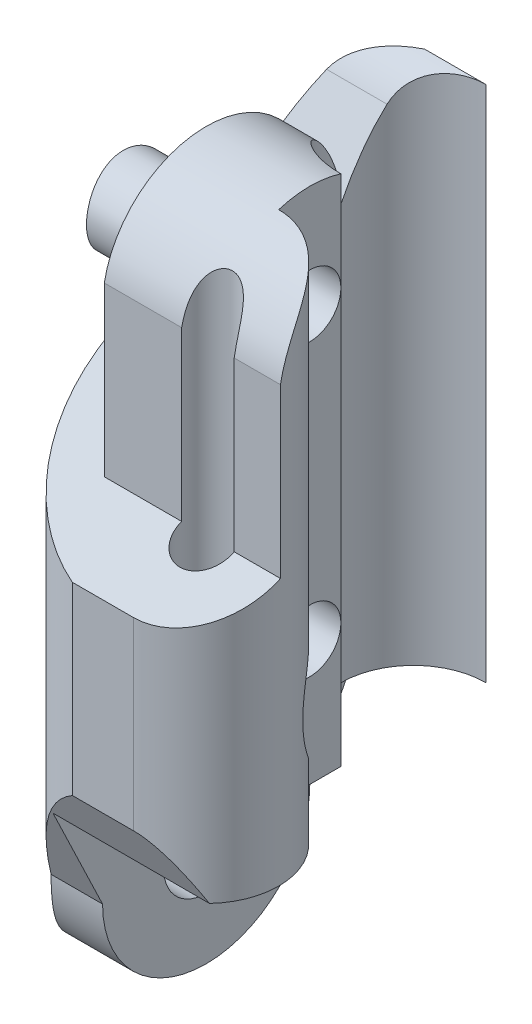
from build123d import *

# Parameters (mm, degrees)
BOSS_EXTRUDE1_DEPTH = 35
SKETCH2_R           = 1.27
CUT_EXTRUDE1_DEPTH  = 35
CUT_EXTRUDE2_REACH  = 41.937
SKETCH3_W           = 10
SKETCH3_H           = 10
SKETCH4_R           = 2.049999964
CUT_EXTRUDE3_DEPTH  = 17.5
CUT_EXTRUDE5_START  = -7.95804
SKETCH6_R           = 2
CUT_EXTRUDE5_DEPTH  = 9.6
FILLET3_R           = 1
CUT_EXTRUDE6_START  = 8.64596
SKETCH6_3_R         = 2
CUT_EXTRUDE6_DEPTH  = 6.604
CUT_EXTRUDE7_START  = -14.986
CUT_EXTRUDE7_DEPTH  = 14.986
CUT_EXTRUDE8_DEPTH  = 31.496
SKETCH9_R           = 1.5
CUT_EXTRUDE9_DEPTH  = 14.224
CUT_EXTRUDE11_DEPTH = 6.048
SKETCH13_R          = 1.5
CUT_EXTRUDE12_DEPTH = 3
CUT_EXTRUDE13_START = -5.5
SKETCH15_R          = 2.75
CUT_EXTRUDE13_DEPTH = 7.572


with BuildPart() as part:
    # Sketch1 → Boss-Extrude1 (new body)
    with BuildSketch(Plane(origin=(0, 0, 0), x_dir=(1, 0, 0), z_dir=(0, 1, 0))):
        with BuildLine():
            Line((-2.958039892, 8.5), (2.958039892, 8.5))
            ThreePointArc((2.958039892, 8.5), (9, 0), (2.958039892, -8.5))
            Line((2.958039892, -8.5), (-2.958039892, -8.5))
            ThreePointArc((-2.958039892, -8.5), (-9, 0), (-2.958039892, 8.5))
        make_face()
    extrude(amount=BOSS_EXTRUDE1_DEPTH)

    # Sketch2 → Cut-Extrude1 (cut)
    with BuildSketch(Plane.XZ):
        with Locations(Location((0, -5, 0), (0, 0, 270))):
            Circle(SKETCH2_R)
        with Locations(Location((0, 5, 0), (0, 0, 270))):
            Circle(SKETCH2_R)
    extrude(amount=-CUT_EXTRUDE1_DEPTH, mode=Mode.SUBTRACT)

    # Cut-Extrude2: up to this face of the body (flat: up to its plane)
    cut_extrude2_end = Plane(part.part.faces().sort_by_distance((0, 17.5, 8.5))[0])
    # Sketch3 → Cut-Extrude2 (cut, up to the picked face)
    with BuildSketch(Plane(origin=(0, 0, -8.5), x_dir=(-1, 0, 0), z_dir=(0, 0, -1)), mode=Mode.PRIVATE) as cut_extrude2_sk1:
        with Locations((0, 5)):
            Rectangle(SKETCH3_W, SKETCH3_H)
    cut_extrude2_tool1 = split(extrude(cut_extrude2_sk1.sketch, amount=-CUT_EXTRUDE2_REACH, mode=Mode.PRIVATE), bisect_by=cut_extrude2_end, keep=Keep.BOTH, mode=Mode.PRIVATE)
    add(cut_extrude2_tool1.solids().sort_by(Axis((0, 5, -8.5), (0, 0, 1)))[0], mode=Mode.SUBTRACT)

    # Sketch4 → Cut-Extrude3 (cut, symmetric)
    with BuildSketch(Plane.ZY.offset(-5)):
        with Locations(Location((0, 5, 0), (0, 0, 270))):
            Circle(SKETCH4_R)
        with BuildLine():
            Line((-7.483314774, 10), (-5, 5))
            ThreePointArc((-5, 5), (0, 0), (5, 5))
            Line((5, 5), (8.5, 12.308552788))
            Line((8.5, 12.308552788), (9.857943437, -1.822240199))
            Line((9.857943437, -1.822240199), (-9.857943437, -1.822240199))
            Line((-9.857943437, -1.822240199), (-7.483314774, 10))
        make_face()
    extrude(amount=CUT_EXTRUDE3_DEPTH, both=True, mode=Mode.SUBTRACT)

    # Sketch6 → Cut-Extrude5 (cut)
    with BuildSketch(Plane.ZY.offset(2.958039892).offset(CUT_EXTRUDE5_START)):
        with BuildLine():
            Line((8.5, 21.219917379), (0, 25))
            ThreePointArc((0, 25), (-3.535533906, 26.464466094), (-5, 30))
            Line((-5, 30), (-6.755867779, 33.535330675))
            ThreePointArc((-6.755867779, 33.535330675), (-7.475170692, 34.449576169), (-8.5, 35))
            Line((-8.5, 35), (17.803004008, 42.886049022))
            Line((17.803004008, 42.886049022), (8.5, 21.219917379))
        make_face()
        with Locations((0, 30)):
            Circle(SKETCH6_R, mode=Mode.SUBTRACT)
    extrude(amount=-CUT_EXTRUDE5_DEPTH, mode=Mode.SUBTRACT)

    # Fillet3
    fillet3_edges = [part.edges().sort_by_distance(p)[0] for p in [
        (0, 10, -3.73),
        (0, 10, 6.27),
    ]]
    fillet(fillet3_edges, radius=FILLET3_R)

    # Sketch6<3> → Cut-Extrude6 (cut)
    with BuildSketch(Plane.ZY.offset(2.958039892).offset(CUT_EXTRUDE6_START)):
        with BuildLine():
            Line((8.5, 21.219917379), (0, 25))
            ThreePointArc((0, 25), (-3.535533906, 26.464466094), (-5, 30))
            Line((-5, 30), (-6.755867779, 33.535330675))
            ThreePointArc((-6.755867779, 33.535330675), (-7.475170692, 34.449576169), (-8.5, 35))
            Line((-8.5, 35), (17.803004008, 42.886049022))
            Line((17.803004008, 42.886049022), (8.5, 21.219917379))
        make_face()
        with Locations((0, 30)):
            Circle(SKETCH6_3_R, mode=Mode.SUBTRACT)
    extrude(amount=-CUT_EXTRUDE6_DEPTH, mode=Mode.SUBTRACT)

    # Sketch7 → Cut-Extrude7 (cut)
    with BuildSketch(Plane(origin=(5, 0, 0), x_dir=(0, 0, -1), z_dir=(1, 0, 0)).offset(CUT_EXTRUDE7_START)):
        with BuildLine():
            Line((5, 30), (6.755867779, 33.535330675))
            ThreePointArc((6.755867779, 33.535330675), (7.475170692, 34.449576169), (8.5, 35))
            Line((8.5, 35), (-8.341946035, 47.536710192))
            Line((-8.341946035, 47.536710192), (-13.168237897, 33.528506419))
            Line((-13.168237897, 33.528506419), (-10.04678731, 20.532036929))
            Line((-10.04678731, 20.532036929), (-4.915473018, 22.814012455))
            Line((-4.915473018, 22.814012455), (-4.915473018, 30.915491676))
            ThreePointArc((-4.915473018, 30.915491676), (0.459692783, 34.97882341), (5, 30))
        make_face()
    extrude(amount=CUT_EXTRUDE7_DEPTH, mode=Mode.SUBTRACT)

    # Sketch8 → Cut-Extrude8 (cut, symmetric)
    with BuildSketch(Plane.XZ.offset(-10)):
        with BuildLine():
            Line((0, 1.5), (0, -1.5))
            ThreePointArc((0, -1.5), (-3.5, -5), (0, -8.5))
            Line((0, -8.5), (-4.790142834, -16.013604782))
            Line((-4.790142834, -16.013604782), (34.96476625, -1.5))
            Line((34.96476625, -1.5), (-4.790142834, 15.219000931))
            Line((-4.790142834, 15.219000931), (0, 8.5))
            ThreePointArc((0, 8.5), (3.5, 5), (0, 1.5))
        make_face()
    extrude(amount=CUT_EXTRUDE8_DEPTH, both=True, mode=Mode.SUBTRACT)

    # Sketch9 → Cut-Extrude9 (cut)
    with BuildSketch(Plane(origin=(0, 0, 0), x_dir=(0, 0, -1), z_dir=(1, 0, 0))):
        with Locations((0, 16)):
            Circle(SKETCH9_R)
    extrude(amount=-CUT_EXTRUDE9_DEPTH, mode=Mode.SUBTRACT)

    # Sketch14 → Cut-Extrude11 (cut)
    with BuildSketch(Plane(origin=(0, 0, 0), x_dir=(0, 0, -1), z_dir=(1, 0, 0))):
        with BuildLine():
            Line((0, 12.5), (0, 19.5))
            ThreePointArc((0, 19.5), (-3.5, 16), (0, 12.5))
        make_face()
    extrude(amount=CUT_EXTRUDE11_DEPTH, mode=Mode.SUBTRACT)

    # Sketch13 → Cut-Extrude12 (cut)
    with BuildSketch(Plane(origin=(0, 0, 0), x_dir=(0, 0, -1), z_dir=(1, 0, 0))):
        with Locations((0, 30)):
            Circle(SKETCH13_R)
    extrude(amount=-CUT_EXTRUDE12_DEPTH, mode=Mode.SUBTRACT)

    # Sketch15 → Cut-Extrude13 (cut)
    with BuildSketch(Plane(origin=(0, 0, 0), x_dir=(0, 0, -1), z_dir=(1, 0, 0)).offset(CUT_EXTRUDE13_START)):
        with Locations((0, 16)):
            Circle(SKETCH15_R)
    extrude(amount=-CUT_EXTRUDE13_DEPTH, mode=Mode.SUBTRACT)


solid = part.part
